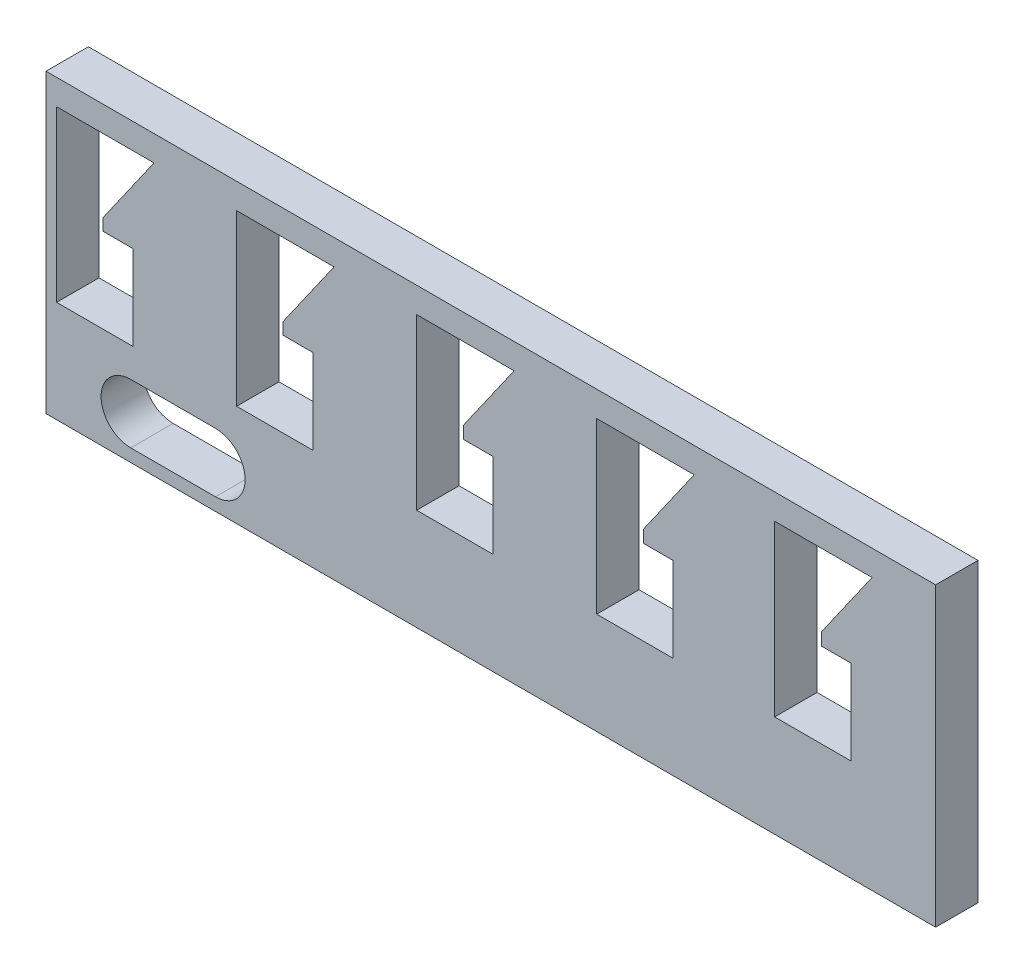
from build123d import *

# Parameters (mm, degrees)
SKETCH1_W           = 105
SKETCH1_H           = 35
BOSS_EXTRUDE1_DEPTH = 5
CUT_EXTRUDE1_DEPTH  = 5
SKETCH3_R           = 2.5
BOSS_EXTRUDE2_DEPTH = 5
CUT_EXTRUDE3_START  = -3.5
SKETCH4_R           = 2.5
SKETCH4_R_2         = 1.5
CUT_EXTRUDE3_DEPTH  = 1.5
CUT_EXTRUDE4_DEPTH  = 5
SKETCH6_W           = 1
SKETCH6_H           = 5.473396058
SKETCH6_H_2         = 2.850644757
SKETCH6_H_3         = 4.642061194
SKETCH6_H_4         = 3.194118723
CUT_EXTRUDE5_DEPTH  = 10


with BuildPart() as part:
    # Sketch1 → Boss-Extrude1 (new body)
    with BuildSketch(Plane.XY):
        with Locations((7.7, 5.6)):
            Rectangle(SKETCH1_W, SKETCH1_H)
    extrude(amount=BOSS_EXTRUDE1_DEPTH)

    # Sketch2 → Cut-Extrude1 (cut)
    with BuildSketch(Plane.XY.offset(5)):
        with BuildLine():
            Line((-34.8, -3.4), (-24.8, -3.4))
            ThreePointArc((-24.8, -3.4), (-21.3, -6.9), (-24.8, -10.4))
            Line((-24.8, -10.4), (-34.8, -10.4))
            ThreePointArc((-34.8, -10.4), (-38.3, -6.9), (-34.8, -3.4))
        make_face()
    extrude(amount=-CUT_EXTRUDE1_DEPTH, mode=Mode.SUBTRACT)

    # Sketch3 → Boss-Extrude2 (add)
    with BuildSketch(Plane(origin=(0, 0, 0), x_dir=(-1, 0, 0), z_dir=(0, 0, -1))):
        with Locations(Location((8.8, -6.9, 0), (0, 0, 180))):
            Circle(SKETCH3_R)
    extrude(amount=BOSS_EXTRUDE2_DEPTH)

    # Sketch4 → Cut-Extrude3 (cut)
    with BuildSketch(Plane(origin=(0, 0, -5), x_dir=(-1, 0, 0), z_dir=(0, 0, -1)).offset(CUT_EXTRUDE3_START)):
        with Locations(Location((8.8, -6.9, 0), (0, 0, 180))):
            Circle(SKETCH4_R)
        with Locations((8.8, -6.9)):
            Circle(SKETCH4_R_2, mode=Mode.SUBTRACT)
    extrude(amount=CUT_EXTRUDE3_DEPTH, mode=Mode.SUBTRACT)

    # Sketch5 → Cut-Extrude4 (cut)
    with BuildSketch(Plane(origin=(0, 0, 0), x_dir=(-1, 0, 0), z_dir=(0, 0, -1))):
        Polygon((-41.2, 0.1), (-50.2, 0.1), (-50.2, 10.1), (-45.7, 10.1), (-52.7, 20.1), (-41.2, 20.1), align=None)
        Polygon((-20.2, 0.1), (-29.2, 0.1), (-29.2, 10.1), (-24.7, 10.1), (-31.7, 20.1), (-20.2, 20.1), align=None)
        Polygon((1.05, 0.1), (-7.95, 0.1), (-7.95, 10.1), (-3.45, 10.1), (-10.45, 20.1), (1.05, 20.1), align=None)
        Polygon((22.3, 0.1), (13.3, 0.1), (13.3, 10.1), (17.8, 10.1), (10.8, 20.1), (22.3, 20.1), align=None)
        Polygon((43.55, 0.1), (34.55, 0.1), (34.55, 10.1), (39.05, 10.1), (32.05, 20.1), (43.55, 20.1), align=None)
    extrude(amount=-CUT_EXTRUDE4_DEPTH, mode=Mode.SUBTRACT)

    # Sketch6 → Cut-Extrude5 (cut)
    with BuildSketch(Plane(origin=(0, 0, 0), x_dir=(-1, 0, 0), z_dir=(0, 0, -1))):
        with Locations((-46.2, 10.54511412)):
            Rectangle(SKETCH6_W, SKETCH6_H)
        with Locations((-25.2, 10.54511412)):
            Rectangle(SKETCH6_W, SKETCH6_H)
        with Locations((-3.95, 10.654861904)):
            Rectangle(SKETCH6_W, SKETCH6_H_2)
        with Locations((17.3, 10.960781552)):
            Rectangle(SKETCH6_W, SKETCH6_H_3)
        with Locations((38.55, 10.826598887)):
            Rectangle(SKETCH6_W, SKETCH6_H_4)
    extrude(amount=-CUT_EXTRUDE5_DEPTH, mode=Mode.SUBTRACT)


solid = part.part
